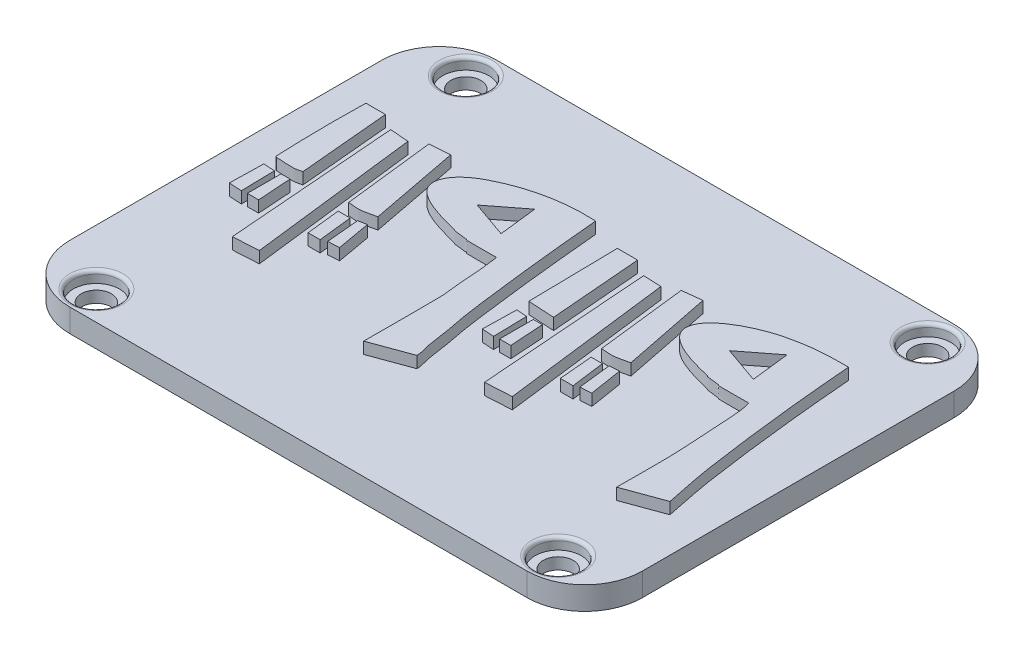
from build123d import *

# Parameters (mm, degrees)
SKETCH_1_W          = 49.6
SKETCH_1_H          = 37
EXTRUDE_1_DEPTH     = 2
FILLET_1_R          = 5
CUT_EXTRUDE_1_REACH = 33.005
SKETCH_2_R          = 1.3
SKETCH_3_R          = 2
CUT_EXTRUDE_2_DEPTH = 1
FILLET_2_R          = 0.3
EXTRUDE_2_DEPTH     = 1


with BuildPart() as part:
    # 草图1 → 凸台-拉伸1 (new body)
    with BuildSketch(Plane(origin=(0, 0, 0), x_dir=(1, 0, 0), z_dir=(0, 1, 0))):
        Rectangle(SKETCH_1_W, SKETCH_1_H)
    extrude(amount=EXTRUDE_1_DEPTH)

    # 圆角1
    fillet_1_edges = [part.edges().sort_by_distance(p)[0] for p in [
        (24.8, 1, 18.5),
        (-24.8, 1, 18.5),
        (-24.8, 1, -18.5),
        (24.8, 1, -18.5),
    ]]
    fillet(fillet_1_edges, radius=FILLET_1_R)

    # 草图2 → 切除-拉伸1 (cut, up to next)
    with BuildSketch(Plane(origin=(0, 2, 0), x_dir=(1, 0, 0), z_dir=(0, 1, 0)), mode=Mode.PRIVATE) as cut_extrude_1_sk1:
        with Locations(Location((-20, 16, 0), (0, 0, 270))):
            Circle(SKETCH_2_R)
    cut_extrude_1_tool1 = extrude(cut_extrude_1_sk1.sketch, amount=-CUT_EXTRUDE_1_REACH, mode=Mode.PRIVATE) & part.part
    # 草图2 → 切除-拉伸1 (cut, up to next)
    with BuildSketch(Plane(origin=(0, 2, 0), x_dir=(1, 0, 0), z_dir=(0, 1, 0)), mode=Mode.PRIVATE) as cut_extrude_1_sk2:
        with Locations(Location((-20, -16, 0), (0, 0, 270))):
            Circle(SKETCH_2_R)
    cut_extrude_1_tool2 = extrude(cut_extrude_1_sk2.sketch, amount=-CUT_EXTRUDE_1_REACH, mode=Mode.PRIVATE) & part.part
    # 草图2 → 切除-拉伸1 (cut, up to next)
    with BuildSketch(Plane(origin=(0, 2, 0), x_dir=(1, 0, 0), z_dir=(0, 1, 0)), mode=Mode.PRIVATE) as cut_extrude_1_sk3:
        with Locations(Location((20, -16, 0), (0, 0, 270))):
            Circle(SKETCH_2_R)
    cut_extrude_1_tool3 = extrude(cut_extrude_1_sk3.sketch, amount=-CUT_EXTRUDE_1_REACH, mode=Mode.PRIVATE) & part.part
    # 草图2 → 切除-拉伸1 (cut, up to next)
    with BuildSketch(Plane(origin=(0, 2, 0), x_dir=(1, 0, 0), z_dir=(0, 1, 0)), mode=Mode.PRIVATE) as cut_extrude_1_sk4:
        with Locations(Location((20, 16, 0), (0, 0, 270))):
            Circle(SKETCH_2_R)
    cut_extrude_1_tool4 = extrude(cut_extrude_1_sk4.sketch, amount=-CUT_EXTRUDE_1_REACH, mode=Mode.PRIVATE) & part.part
    add(cut_extrude_1_tool1.solids().sort_by_distance((-20, 2, -16))[0], mode=Mode.SUBTRACT)
    add(cut_extrude_1_tool2.solids().sort_by_distance((-20, 2, 16))[0], mode=Mode.SUBTRACT)
    add(cut_extrude_1_tool3.solids().sort_by_distance((20, 2, 16))[0], mode=Mode.SUBTRACT)
    add(cut_extrude_1_tool4.solids().sort_by_distance((20, 2, -16))[0], mode=Mode.SUBTRACT)

    # 草图3 → 切除-拉伸2 (cut)
    with BuildSketch(Plane(origin=(0, 2, 0), x_dir=(1, 0, 0), z_dir=(0, 1, 0))):
        with Locations(Location((-20, 16, 0), (0, 0, 270))):
            Circle(SKETCH_3_R)
        with Locations(Location((20, 16, 0), (0, 0, 90))):
            Circle(SKETCH_3_R)
        with Locations(Location((20, -16, 0), (0, 0, 270))):
            Circle(SKETCH_3_R)
        with Locations(Location((-20, -16, 0), (0, 0, 90))):
            Circle(SKETCH_3_R)
    extrude(amount=-CUT_EXTRUDE_2_DEPTH, mode=Mode.SUBTRACT)

    # 圆角2
    fillet_2_edges = [part.edges().sort_by_distance(p)[0] for p in [
        (-20, 2, 18),
        (20, 2, 14),
        (20, 2, -14),
        (-20, 2, -18),
    ]]
    fillet(fillet_2_edges, radius=FILLET_2_R)

    # 草图4 → 凸台-拉伸2 (add)
    # profile 1 of 16: a face of its own
    with BuildSketch(Plane(origin=(0, 2, 0), x_dir=(1, 0, 0), z_dir=(0, 1, 0))):
        with BuildLine():
            Line((21.772779449, -8.095391306), (18.392470655, -9.330504134))
            add(Edge.make_bspline(
                [(18.392470655, -9.330504134), (18.392470655, -7.271868711), (18.455878866, -5.209566383), (18.327464716, -3.154939991), (18.284127424, -2.461543315), (18.256785252, -1.766961446), (18.19745284, -1.074749964), (18.117883761, -0.146444045), (18.129446344, 1.729507058), (17.807417209, 2.695594461)],
                knots=[0, 0, 0, 0, 1, 1, 1, 2, 2, 2, 3, 3, 3, 3], degree=3))
            add(Edge.make_bspline(
                [(17.807417209, 2.695594461), (16.940671365, 2.695594461), (16.073667828, 2.674460603), (15.207179675, 2.695594461), (15.176544693, 2.696341655), (15.172400884, 2.755562541), (15.142173737, 2.760600399), (14.776312856, 2.821577212), (14.402933666, 2.829635462), (14.037072785, 2.890612276), (14.006845638, 2.895650134), (14.001795984, 2.94818593), (13.972066847, 2.955618214), (12.87353701, 3.230250673), (9.335911632, 3.97107703), (9.421651162, 5.685867625), (9.510559325, 7.464030884), (12.920686217, 8.866721722), (14.362102477, 9.196188296), (14.90065745, 9.319286575), (15.441480477, 9.435606935), (15.987250936, 9.521217987), (17.123631614, 9.69947378), (18.282289105, 9.716235802), (19.432565668, 9.716235802)],
                knots=[0, 0, 0, 0, 1, 1, 1, 2, 2, 2, 3, 3, 3, 4, 4, 4, 5, 5, 5, 6, 6, 6, 7, 7, 7, 8, 8, 8, 8], degree=3))
            add(Edge.make_bspline(
                [(19.432565668, 9.716235802), (19.806886753, 5.074654356), (20.299015723, 0.513347145), (20.992708189, -4.065023128), (21.168371545, -5.224401279), (21.555088387, -6.93437231), (21.772779449, -8.095391306)],
                knots=[0, 0, 0, 0, 1, 1, 1, 2, 2, 2, 2], degree=3))
        make_face()
        Polygon((16.227936537, 4.674916894), (15.846361476, 7.972815636), (13.042065388, 5.791333279), align=None, mode=Mode.SUBTRACT)
    # profile 2 of 16: a face of its own
    with BuildSketch(Plane(origin=(0, 2, 0), x_dir=(1, 0, 0), z_dir=(0, 1, 0))):
        with BuildLine():
            Line((-0.134221775, -8.095391306), (-3.51453057, -9.330504134))
            add(Edge.make_bspline(
                [(-3.51453057, -9.330504134), (-3.51453057, -7.098633584), (-3.493071268, -4.866659867), (-3.51453057, -2.634892484), (-3.518893044, -2.181195119), (-3.66805424, -1.168812691), (-3.709548385, -0.684714334), (-3.774554323, 0.073688281), (-3.779428406, 0.839666745), (-3.9045662, 1.590493509), (-3.965543013, 1.956354389), (-3.991240784, 2.327227477), (-4.034578076, 2.695594461)],
                knots=[0, 0, 0, 0, 1, 1, 1, 2, 2, 2, 3, 3, 3, 4, 4, 4, 4], degree=3))
            add(Edge.make_bspline(
                [(-4.034578076, 2.695594461), (-4.901323921, 2.695594461), (-5.768327457, 2.674460603), (-6.63481561, 2.695594461), (-6.665450593, 2.696341655), (-6.669552448, 2.755821067), (-6.699821549, 2.760600399), (-7.087455169, 2.821805708), (-7.482294818, 2.829406967), (-7.869928439, 2.890612276), (-7.900197539, 2.895391607), (-7.905370065, 2.94755522), (-7.934934377, 2.955618214), (-9.074310116, 3.266357052), (-12.329170549, 3.940899047), (-12.420344124, 5.49084981), (-12.486172717, 6.609935897), (-11.292516664, 7.548273989), (-10.405160035, 8.026081405), (-8.004942131, 9.31850643), (-5.186345635, 9.875759925), (-2.474435556, 9.716235802)],
                knots=[0, 0, 0, 0, 1, 1, 1, 2, 2, 2, 3, 3, 3, 4, 4, 4, 5, 5, 5, 6, 6, 6, 7, 7, 7, 7], degree=3))
            add(Edge.make_bspline(
                [(-2.474435556, 9.716235802), (-2.101496817, 5.55175322), (-1.681377293, 1.548991842), (-1.109310851, -2.569886546), (-1.030641335, -3.136307059), (-0.824660278, -4.135464695), (-0.71927522, -4.715082511), (-0.59373164, -5.405572203), (-0.519789109, -6.104782846), (-0.394245529, -6.795272539), (-0.329309304, -7.152421774), (-0.134221775, -7.684510904), (-0.134221775, -8.095391306)],
                knots=[0, 0, 0, 0, 1, 1, 1, 2, 2, 2, 3, 3, 3, 4, 4, 4, 4], degree=3))
        make_face()
        Polygon((-5.622033199, 4.674916894), (-6.00360826, 7.972815636), (-8.807904349, 5.791333279), align=None, mode=Mode.SUBTRACT)
    # profile 3 of 16: a face of its own
    with BuildSketch(Plane(origin=(0, 2, 0), x_dir=(1, 0, 0), z_dir=(0, 1, 0))):
        Polygon((7.081437382, -7.055296292), (4.806229539, -7.185308169), (3.701128587, 7.701051714), (5.261271108, 7.636045775), align=None)
    # profile 4 of 16: a face of its own
    with BuildSketch(Plane(origin=(0, 2, 0), x_dir=(1, 0, 0), z_dir=(0, 1, 0))):
        Polygon((-14.825563842, -7.055296292), (-17.035765746, -7.185308169), (-18.205872637, 7.701051714), (-16.580724178, 7.571039837), align=None)
    # profile 5 of 16: a face of its own
    with BuildSketch(Plane(origin=(0, 2, 0), x_dir=(1, 0, 0), z_dir=(0, 1, 0))):
        Polygon((8.901603655, -3.609981559), (7.796502703, -3.609981559), (7.53647895, -0.684714334), (8.511568025, -0.684714334), align=None)
    # profile 6 of 16: a face of its own
    with BuildSketch(Plane(origin=(0, 2, 0), x_dir=(1, 0, 0), z_dir=(0, 1, 0))):
        Polygon((-13.005397569, -3.609981559), (-14.045492582, -3.609981559), (-14.370522274, -0.684714334), (-13.33042726, -0.684714334), align=None)
    # profile 7 of 16: a face of its own
    with BuildSketch(Plane(origin=(0, 2, 0), x_dir=(1, 0, 0), z_dir=(0, 1, 0))):
        Polygon((9.291639286, -3.414963744), (8.966609594, -0.554702457), (9.811686792, -0.489696519), (10.266728361, -3.349957806), align=None)
    # profile 8 of 16: a face of its own
    with BuildSketch(Plane(origin=(0, 2, 0), x_dir=(1, 0, 0), z_dir=(0, 1, 0))):
        Polygon((-12.550356, -3.414963744), (-12.810379754, -0.554702457), (-12.095314432, -0.42469058), (-11.575266925, -3.349957806), align=None)
    # profile 9 of 16: a face of its own
    with BuildSketch(Plane(origin=(0, 2, 0), x_dir=(1, 0, 0), z_dir=(0, 1, 0))):
        Polygon((2.205992005, -3.284951868), (2.205992005, -0.359684642), (2.986063266, -0.359684642), (3.181081081, -3.284951868), align=None)
    # profile 10 of 16: a face of its own
    with BuildSketch(Plane(origin=(0, 2, 0), x_dir=(1, 0, 0), z_dir=(0, 1, 0))):
        Polygon((1.750950437, -3.349957806), (0.710855423, -3.284951868), (0.775861362, -0.359684642), (1.685944499, -0.42469058), align=None)
    # profile 11 of 16: a face of its own
    with BuildSketch(Plane(origin=(0, 2, 0), x_dir=(1, 0, 0), z_dir=(0, 1, 0))):
        Polygon((-19.63600328, -3.284951868), (-19.63600328, -0.359684642), (-18.85593202, -0.359684642), (-18.660914205, -3.284951868), align=None)
    # profile 12 of 16: a face of its own
    with BuildSketch(Plane(origin=(0, 2, 0), x_dir=(1, 0, 0), z_dir=(0, 1, 0))):
        Polygon((-20.091044849, -3.349957806), (-21.196145801, -3.284951868), (-21.131139862, -0.359684642), (-20.156050787, -0.42469058), align=None)
    # profile 13 of 16: a face of its own
    with BuildSketch(Plane(origin=(0, 2, 0), x_dir=(1, 0, 0), z_dir=(0, 1, 0))):
        with BuildLine():
            Line((7.341461135, 0.420386618), (6.431377998, 8.22109922))
            Line((6.431377998, 8.22109922), (8.121532395, 8.416117035))
            Line((8.121532395, 8.416117035), (9.681674916, 0.615404433))
            add(Edge.make_bspline(
                [(9.681674916, 0.615404433), (9.248301993, 0.528729849), (8.821984925, 0.392083078), (8.381556149, 0.35538068), (8.035381242, 0.326532771), (7.688159473, 0.398717972), (7.341461135, 0.420386618)],
                knots=[0, 0, 0, 0, 1, 1, 1, 2, 2, 2, 2], degree=3))
        make_face()
    # profile 14 of 16: a face of its own
    with BuildSketch(Plane(origin=(0, 2, 0), x_dir=(1, 0, 0), z_dir=(0, 1, 0))):
        with BuildLine():
            Line((-14.565540089, 0.420386618), (-15.475623226, 8.286105159))
            Line((-15.475623226, 8.286105159), (-13.720462891, 8.416117035))
            Line((-13.720462891, 8.416117035), (-12.225326308, 0.615404433))
            add(Edge.make_bspline(
                [(-12.225326308, 0.615404433), (-12.658699231, 0.528729849), (-13.085016299, 0.392083078), (-13.525445075, 0.35538068), (-13.871619982, 0.326532771), (-14.218841751, 0.398717972), (-14.565540089, 0.420386618)],
                knots=[0, 0, 0, 0, 1, 1, 1, 2, 2, 2, 2], degree=3))
        make_face()
    # profile 15 of 16: a face of its own
    with BuildSketch(Plane(origin=(0, 2, 0), x_dir=(1, 0, 0), z_dir=(0, 1, 0))):
        Polygon((2.921057327, 0.680410372), (0.645849485, 0.810422248), (0.515837608, 8.611134851), (2.270997944, 8.611134851), align=None)
    # profile 16 of 16: a face of its own
    with BuildSketch(Plane(origin=(0, 2, 0), x_dir=(1, 0, 0), z_dir=(0, 1, 0))):
        with BuildLine():
            Line((-21.261151739, 8.611134851), (-19.570997342, 8.611134851))
            Line((-19.570997342, 8.611134851), (-18.85593202, 0.74541631))
            add(Edge.make_bspline(
                [(-18.85593202, 0.74541631), (-19.094898602, 0.705588546), (-19.328734514, 0.615404433), (-19.570997342, 0.615404433), (-20.069847038, 0.615404433), (-20.569007376, 0.638983159), (-21.066133924, 0.680410372), (-21.127210406, 0.685500079), (-21.19403367, 0.749170467), (-21.196145801, 0.810422248), (-21.285759015, 3.409205471), (-21.337598911, 6.011931012), (-21.261151739, 8.611134851)],
                knots=[0, 0, 0, 0, 1, 1, 1, 2, 2, 2, 3, 3, 3, 4, 4, 4, 4], degree=3))
        make_face()
    extrude(amount=EXTRUDE_2_DEPTH)


solid = part.part
